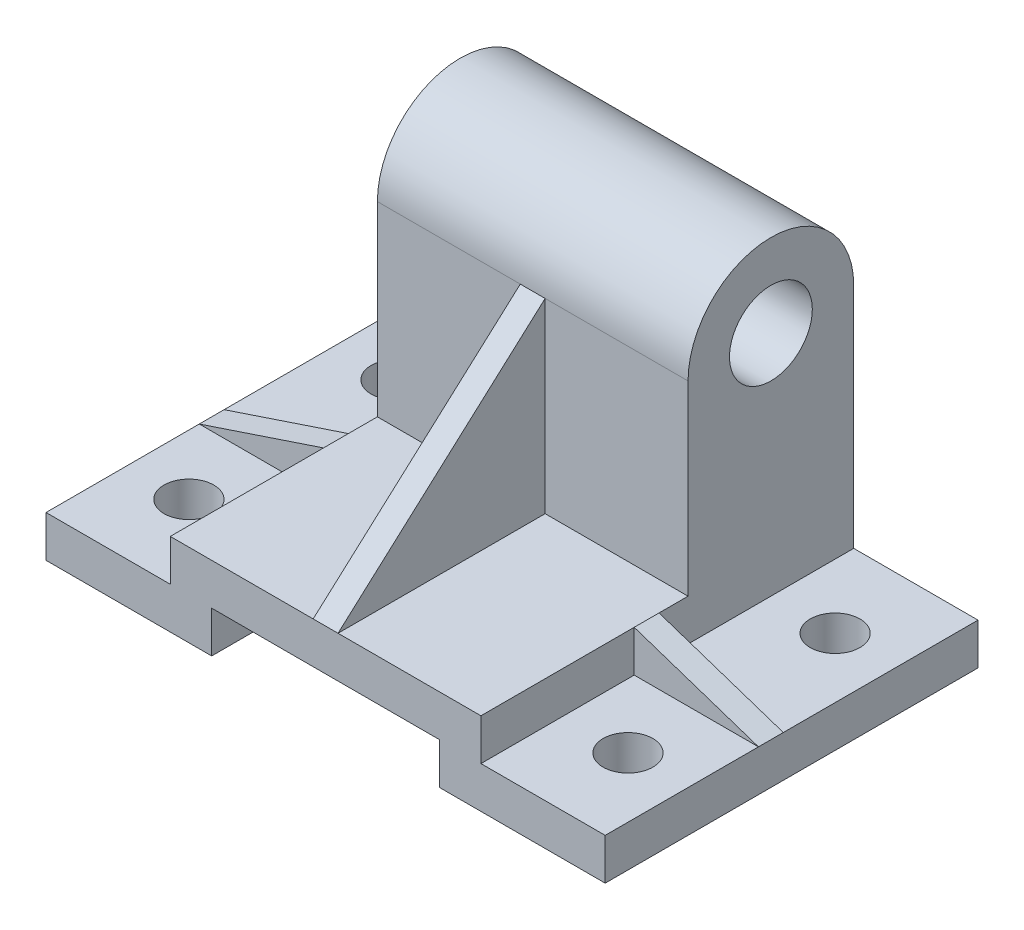
from build123d import *

# Parameters (mm, degrees)
BOSS_EXTRUDE1_DEPTH = 45
RIB1_REACH          = 86.595
SKETCH3_WALL_W      = 202.812019758
SKETCH3_WALL_H      = 6
SKETCH5_R           = 6
CUT_EXTRUDE1_DEPTH  = 90
SKETCH6_R           = 6
CUT_EXTRUDE2_DEPTH  = 90
SKETCH7_R           = 10
BOSS_EXTRUDE2_DEPTH = 37.5
RIB2_REACH          = 112.482
SKETCH8_WALL_W      = 290.231918176
SKETCH8_WALL_H      = 6


with BuildPart() as part:
    # Sketch1 → Boss-Extrude1 (new, symmetric)
    with BuildSketch(Plane.XY):
        Polygon((0, 0), (27.5, 0), (27.5, -10), (67.5, -10), (67.5, 0), (37.5, 0), (37.5, 10), (-37.5, 10), (-37.5, 0), (-67.5, 0), (-67.5, -10), (-27.5, -10), (-27.5, 0), align=None)
    extrude(amount=BOSS_EXTRUDE1_DEPTH, both=True)

    # Sketch3 wall → Rib1 (add, up to next)
    with BuildSketch(Plane(origin=(52.5, 5, 5), x_dir=(0.948683298051, -0.316227766017, 0), z_dir=(0.316227766017, 0.948683298051, 0)), mode=Mode.PRIVATE) as rib1_sk1:
        Rectangle(SKETCH3_WALL_W, SKETCH3_WALL_H)
    rib1_tool1 = extrude(rib1_sk1.sketch, amount=-RIB1_REACH, mode=Mode.PRIVATE) - part.part
    rib1 = rib1_tool1.solids().sort_by_distance((52.5, 5, 5))[0]
    add(rib1)

    # Mirror1: Rib1 across plane
    add(rib1.mirror(Plane(origin=(0, 0, 0), x_dir=(0, 0, 1), z_dir=(1, 0, 0))))

    # Sketch5 → Cut-Extrude1 (cut)
    with BuildSketch(Plane(origin=(0, 0, 0), x_dir=(1, 0, 0), z_dir=(0, 1, 0))):
        with Locations(Location((53, -25, 0), (0, 0, 180))):
            Circle(SKETCH5_R)
    cut_extrude1 = extrude(amount=-CUT_EXTRUDE1_DEPTH, mode=Mode.SUBTRACT)

    # Mirror2: Cut-Extrude1 across plane
    add(cut_extrude1.mirror(Plane(origin=(0, 0, 0), x_dir=(0, 0, 1), z_dir=(1, 0, 0))), mode=Mode.SUBTRACT)

    # Sketch6 → Cut-Extrude2 (cut)
    with BuildSketch(Plane(origin=(0, 0, 0), x_dir=(1, 0, 0), z_dir=(0, 1, 0))):
        with Locations(Location((53, 25, 0), (0, 0, 180))):
            Circle(SKETCH6_R)
    cut_extrude2 = extrude(amount=-CUT_EXTRUDE2_DEPTH, mode=Mode.SUBTRACT)

    # Mirror3: Cut-Extrude2 across plane
    add(cut_extrude2.mirror(Plane(origin=(0, 0, 0), x_dir=(0, 0, 1), z_dir=(1, 0, 0))), mode=Mode.SUBTRACT)

    # Sketch7 → Boss-Extrude2 (add, symmetric)
    with BuildSketch(Plane(origin=(0, 0, 0), x_dir=(0, 0, -1), z_dir=(1, 0, 0))):
        with BuildLine():
            Line((5, 10), (45, 10))
            Line((45, 10), (45, 55))
            ThreePointArc((45, 55), (25, 75), (5, 55))
            Line((5, 55), (5, 10))
        make_face()
        with Locations((25, 55)):
            Circle(SKETCH7_R, mode=Mode.SUBTRACT)
    extrude(amount=BOSS_EXTRUDE2_DEPTH, both=True)

    # Sketch8 wall → Rib2 (add, up to next)
    with BuildSketch(Plane(origin=(0, 32.5, 20), x_dir=(0, -0.668964731622, 0.743294146247), z_dir=(0, -0.743294146247, -0.668964731622)), mode=Mode.PRIVATE) as rib2_sk1:
        Rectangle(SKETCH8_WALL_W, SKETCH8_WALL_H)
    rib2_tool1 = extrude(rib2_sk1.sketch, amount=RIB2_REACH, mode=Mode.PRIVATE) - part.part
    add(rib2_tool1.solids().sort_by_distance((0, 32.5, 20))[0])


solid = part.part
